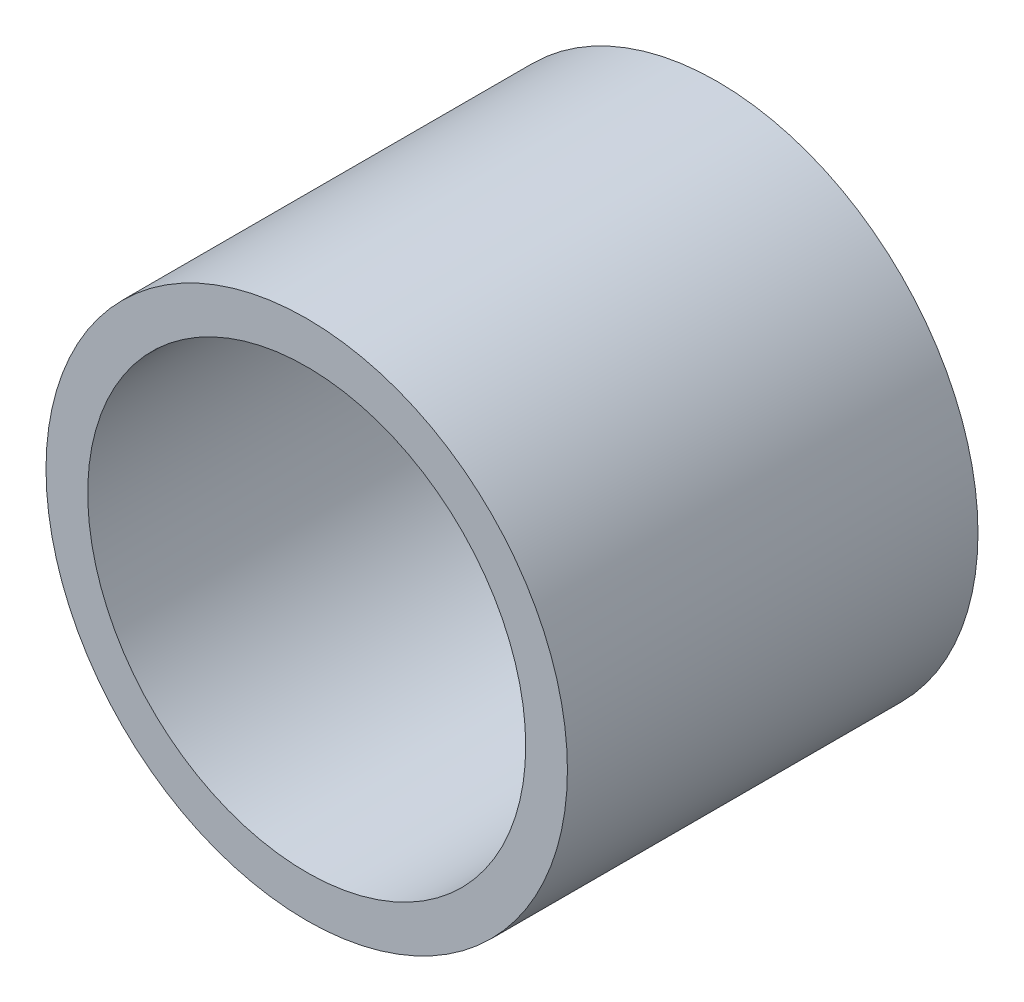
from build123d import *

# Parameters (mm, degrees)
SKETCH1_R           = 3.175
SKETCH1_R_2         = 2.667
BOSS_EXTRUDE1_DEPTH = 5


with BuildPart() as part:
    # Sketch1 → Boss-Extrude1 (new body)
    with BuildSketch(Plane.XY):
        Circle(SKETCH1_R)
        Circle(SKETCH1_R_2, mode=Mode.SUBTRACT)
    extrude(amount=BOSS_EXTRUDE1_DEPTH)


solid = part.part
